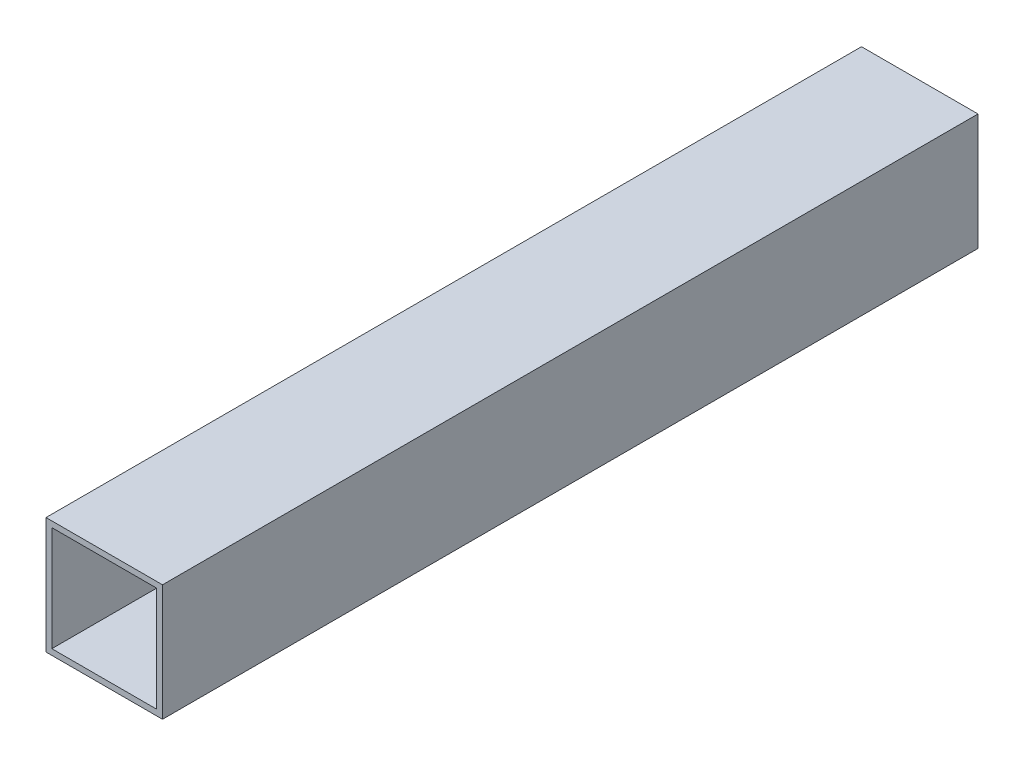
from build123d import *

# Parameters (mm, degrees)
SKETCH1_W           = 50.8
SKETCH1_H           = 50.8
SKETCH1_W_2         = 45.72
SKETCH1_H_2         = 45.72
BOSS_EXTRUDE1_DEPTH = 355.6


with BuildPart() as part:
    # Sketch1 → Boss-Extrude1 (new body)
    with BuildSketch(Plane.XY):
        with Locations((27.032857143, 25.4)):
            Rectangle(SKETCH1_W, SKETCH1_H)
        with Locations((27.032857143, 25.4)):
            Rectangle(SKETCH1_W_2, SKETCH1_H_2, mode=Mode.SUBTRACT)
    extrude(amount=BOSS_EXTRUDE1_DEPTH)


solid = part.part
